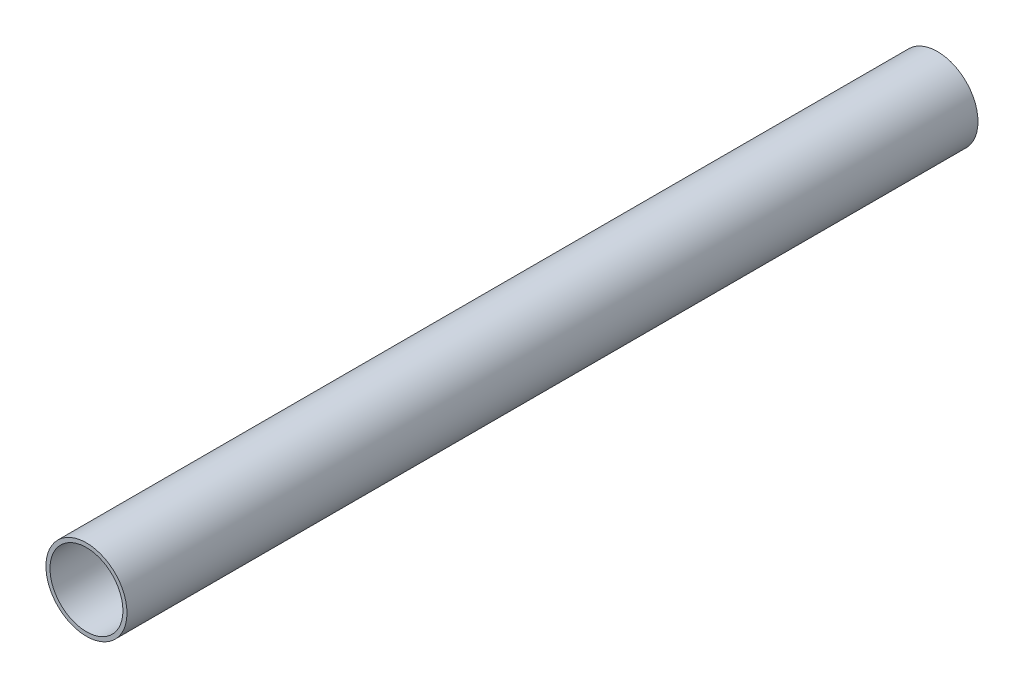
from build123d import *

# Parameters (mm, degrees)
SCHIZZO1_R                   = 10
SCHIZZO1_R_2                 = 9
ESTRUSIONE_ESTRUSIONE1_DEPTH = 210


with BuildPart() as part:
    # Schizzo1 → Estrusione-Estrusione1 (new body)
    with BuildSketch(Plane.XY):
        Circle(SCHIZZO1_R)
        Circle(SCHIZZO1_R_2, mode=Mode.SUBTRACT)
    extrude(amount=ESTRUSIONE_ESTRUSIONE1_DEPTH)


solid = part.part
